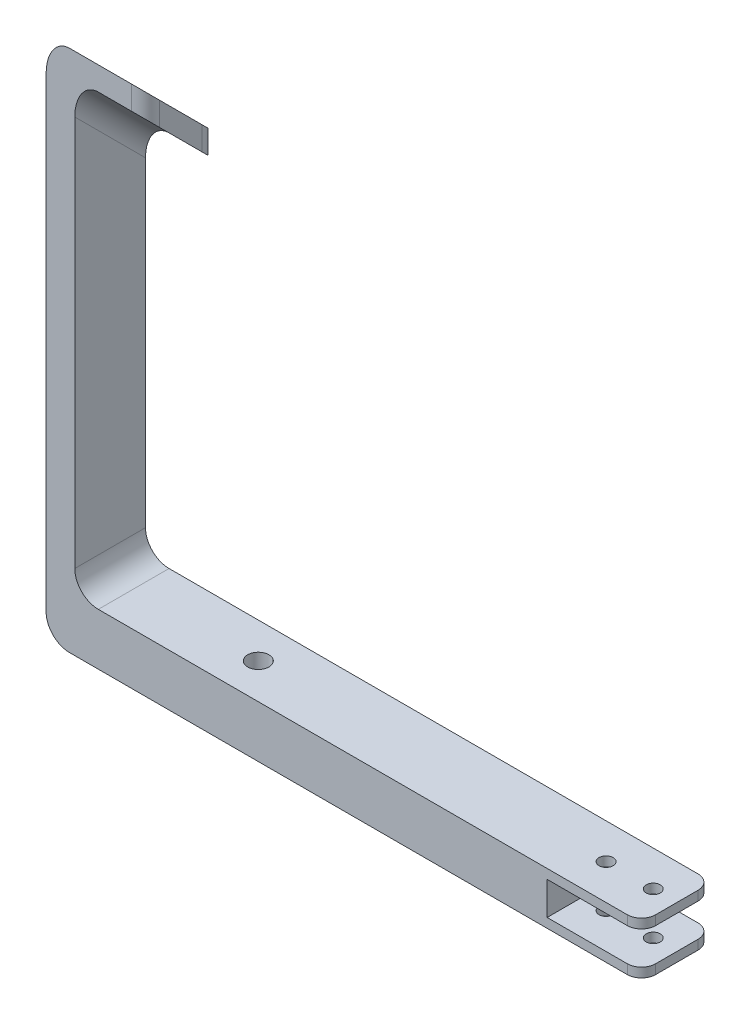
from build123d import *

# Parameters (mm, degrees)
SALIENTE_EXTRUIR1_DEPTH = 7.5
CROQUIS2_R              = 1.5
CORTAR_EXTRUIR1_DEPTH   = 147.100350787
REDONDEO1_R             = 3
REDONDEO2_R             = 3
CORTAR_EXTRUIR3_DEPTH   = 161.092886788
CROQUIS5_R              = 2.25
CORTAR_EXTRUIR4_DEPTH   = 133.941951618
CORTAR_EXTRUIR5_DEPTH   = 161.092886788
REDONDEO3_R             = 5
CROQUIS7_R              = 2.25
CORTAR_EXTRUIR6_DEPTH   = 7


with BuildPart() as part:
    # Croquis1 → Saliente-Extruir1 (new, symmetric)
    with BuildSketch(Plane.XY):
        Polygon((0, -3.5), (0, 3.5), (20, 3.5), (20, 5.5), (-100.18, 5.5), (-100.18, 85.5), (-85.18, 85.5), (-85.18, 105.5), (-106.25, 105.5), (-106.25, -5.5), (20, -5.5), (20, -3.5), align=None)
    extrude(amount=SALIENTE_EXTRUIR1_DEPTH, both=True)

    # Croquis2 → Cortar-Extruir1 (cut, through all)
    with BuildSketch(Plane(origin=(0, 5.5, 0), x_dir=(1, 0, 0), z_dir=(0, 1, 0))):
        with Locations(Location((15, 0, 0), (0, 0, 180))):
            Circle(CROQUIS2_R)
        with Locations(Location((5, 0, 0), (0, 0, 180))):
            Circle(CROQUIS2_R)
    extrude(amount=-CORTAR_EXTRUIR1_DEPTH, mode=Mode.SUBTRACT)

    # Redondeo1
    redondeo1_edges = [part.edges().sort_by_distance(p)[0] for p in [
        (20, -4.5, -7.5),
        (20, 4.5, -7.5),
        (20, 4.5, 7.5),
        (20, -4.5, 7.5),
    ]]
    fillet(redondeo1_edges, radius=REDONDEO1_R)

    # Redondeo2
    redondeo2_edges = [part.edges().sort_by_distance(p)[0] for p in [
        (-85.18, 95.5, -7.5),
        (-85.18, 95.5, 7.5),
    ]]
    fillet(redondeo2_edges, radius=REDONDEO2_R)

    # Croquis4 → Cortar-Extruir3 (cut, through all)
    with BuildSketch(Plane(origin=(-100.18, 0, 0), x_dir=(0, 0, -1), z_dir=(1, 0, 0))):
        Polygon((-7.5, 105.5), (7.5, 90.5), (7.5, 105.5), align=None)
        Polygon((-7.5, 100.5), (7.5, 85.5), (-7.5, 85.5), align=None)
    extrude(amount=CORTAR_EXTRUIR3_DEPTH, mode=Mode.SUBTRACT)

    # Croquis5 → Cortar-Extruir4 (cut, through all)
    with BuildSketch(Plane(origin=(0, 49, -49), x_dir=(1, 0, 0), z_dir=(0, 0.7071067811865512, -0.7071067811865439))):
        with Locations(Location((-89.98, -69.296464556, 0), (0, 0, 270))):
            Circle(CROQUIS5_R)
    extrude(amount=-CORTAR_EXTRUIR4_DEPTH, mode=Mode.SUBTRACT)

    # Croquis6 → Cortar-Extruir5 (cut, through all)
    with BuildSketch(Plane(origin=(-100.18, 0, 0), x_dir=(0, 0, -1), z_dir=(1, 0, 0))):
        Polygon((7.5, 90.5), (7.5, 105.5), (-7.5, 105.5), align=None)
    extrude(amount=-CORTAR_EXTRUIR5_DEPTH, mode=Mode.SUBTRACT)

    # Redondeo3
    redondeo3_edges = [part.edges().sort_by_distance(p)[0] for p in [
        (-100.18, 93, 0),
        (-106.25, 98, 0),
        (-106.25, -5.5, 0),
        (-100.18, 5.5, 0),
    ]]
    fillet(redondeo3_edges, radius=REDONDEO3_R)

    # Croquis7 → Cortar-Extruir6 (cut)
    with BuildSketch(Plane(origin=(0, 5.5, 0), x_dir=(1, 0, 0), z_dir=(0, 1, 0))):
        with Locations(Location((-68.75, 0, 0), (0, 0, 180))):
            Circle(CROQUIS7_R)
    extrude(amount=-CORTAR_EXTRUIR6_DEPTH, mode=Mode.SUBTRACT)


solid = part.part
